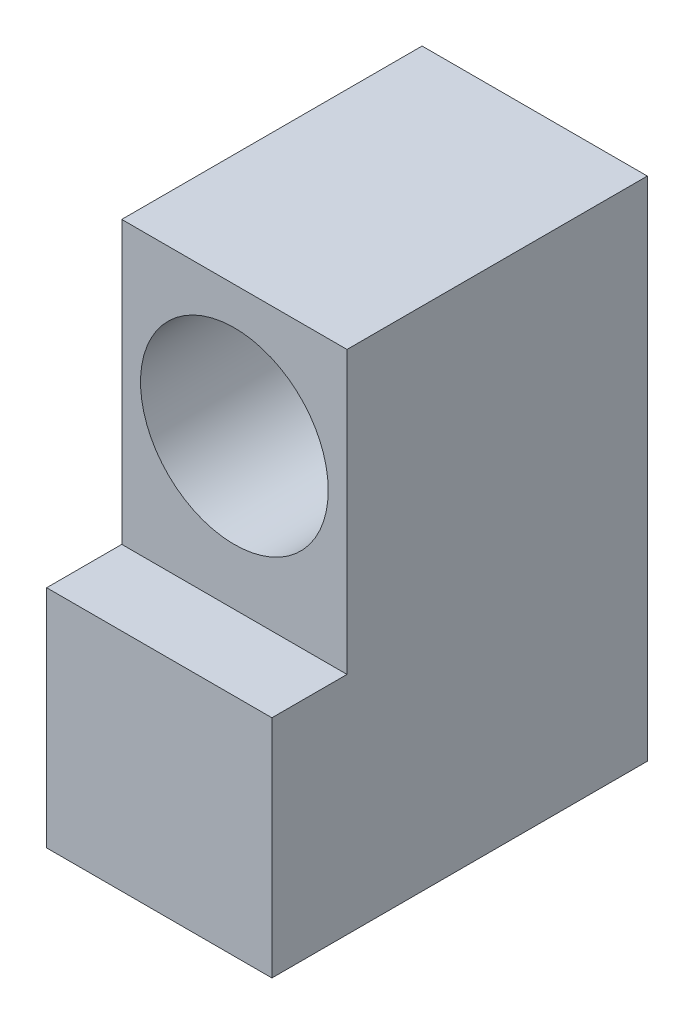
from build123d import *

# Parameters (mm, degrees)
SKETCH_1_R             = 2.5
EXTRUDE_1_DEPTH        = 8
SKETCH_5_W             = 6
SKETCH_5_H             = 6.003393665
EXTRUDE_4_DEPTH        = 2
SKETCH_6_W             = 5
SKETCH_6_H             = 6
EXTRUDE_5_DEPTH        = 5
HOLE_WIZARD_M2_1_D     = 1.6
HOLE_WIZARD_M2_1_DEPTH = 5
HOLE_WIZARD_M2_1_TIP   = 0.480688495


with BuildPart() as part:
    # 스케치1 → 돌출1 (new body)
    with BuildSketch(Plane.XY):
        Polygon((0, 0), (0.5, 0), (0.5, 6), (5.5, 6), (5.5, 0), (6, 0), (6, 13.5), (0, 13.5), align=None)
        with Locations((3, 10)):
            Circle(SKETCH_1_R, mode=Mode.SUBTRACT)
    extrude(amount=EXTRUDE_1_DEPTH)

    # 스케치5 → 돌출4 (add)
    with BuildSketch(Plane.XY.offset(8)):
        with Locations((3, 3.001696832)):
            Rectangle(SKETCH_5_W, SKETCH_5_H)
    extrude(amount=EXTRUDE_4_DEPTH)

    # 스케치6 → 돌출5 (add)
    with BuildSketch(Plane(origin=(0, 0, 8), x_dir=(-1, 0, 0), z_dir=(0, 0, -1))):
        with Locations((-3, 3)):
            Rectangle(SKETCH_6_W, SKETCH_6_H)
    extrude(amount=EXTRUDE_5_DEPTH)

    # M2 탭을 위한 탭 드릴1
    with Locations(Plane.XZ):
        with Locations((3, 7)):
            Hole(HOLE_WIZARD_M2_1_D / 2, depth=HOLE_WIZARD_M2_1_DEPTH)
            with Locations((0, 0, -(HOLE_WIZARD_M2_1_DEPTH + HOLE_WIZARD_M2_1_TIP / 2))):  # 118° drill point
                Cone(0, HOLE_WIZARD_M2_1_D / 2, HOLE_WIZARD_M2_1_TIP, mode=Mode.SUBTRACT)


solid = part.part
